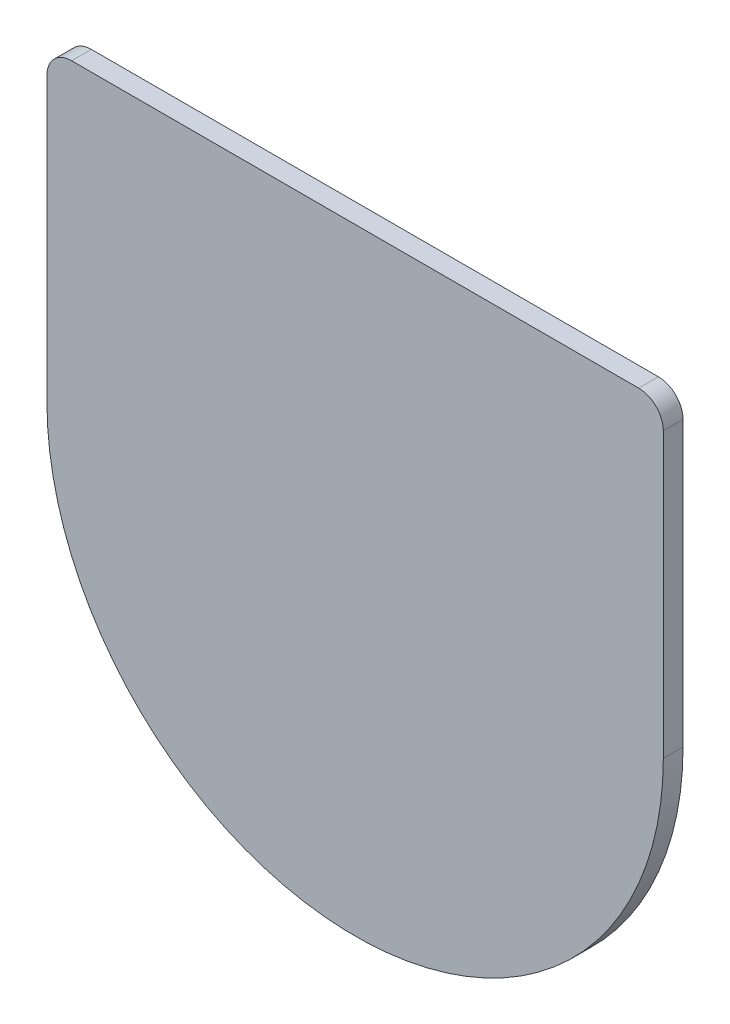
from build123d import *

# Parameters (mm, degrees)
BOSS_EXTRU_1_DEPTH = 8


with BuildPart() as part:
    # Esquisse1 → Boss.-Extru.1 (new body)
    with BuildSketch(Plane.XY):
        with BuildLine():
            Line((-125, -62.5), (-125, 52.5))
            ThreePointArc((-125, 52.5), (-122.071067812, 59.571067812), (-115, 62.5))
            Line((-115, 62.5), (115, 62.5))
            ThreePointArc((115, 62.5), (122.071067812, 59.571067812), (125, 52.5))
            Line((125, 52.5), (125, -62.5))
            ThreePointArc((125, -62.5), (0, -187.5), (-125, -62.5))
        make_face()
    extrude(amount=BOSS_EXTRU_1_DEPTH)


solid = part.part
